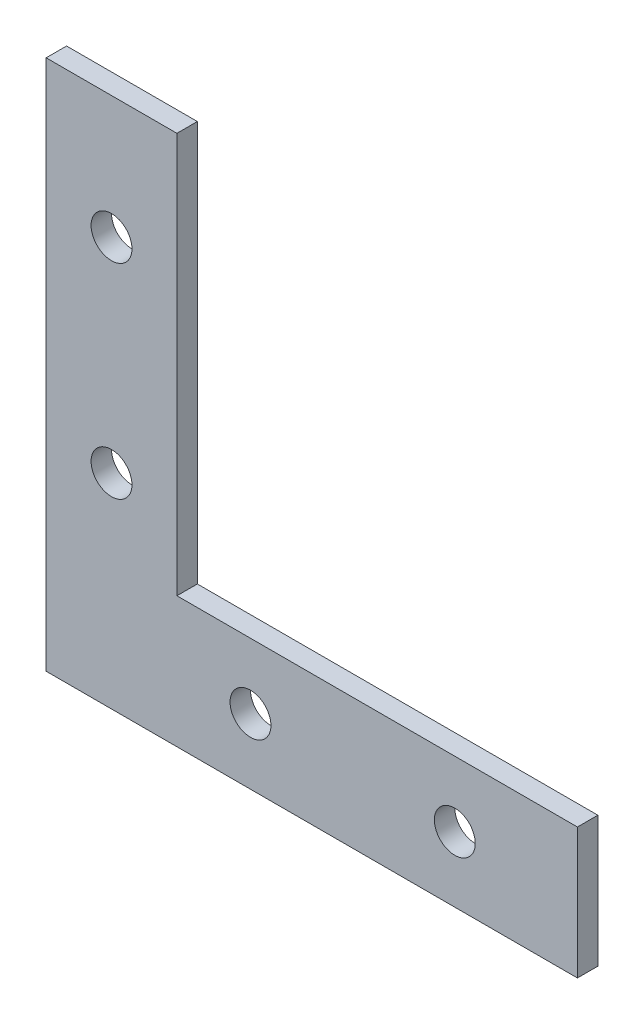
from build123d import *

# Parameters (mm, degrees)
SKETCH1_R           = 2.5
BOSS_EXTRUDE1_DEPTH = 1.25


with BuildPart() as part:
    # Sketch1 → Boss-Extrude1 (new, symmetric)
    with BuildSketch(Plane.XY):
        Polygon((0, 0), (65, 0), (65, 16), (16, 16), (16, 65), (0, 65), align=None)
        with Locations((25, 8)):
            Circle(SKETCH1_R, mode=Mode.SUBTRACT)
        with Locations((50, 8)):
            Circle(SKETCH1_R, mode=Mode.SUBTRACT)
        with Locations(Location((8, 50, 0), (0, 0, 180))):
            Circle(SKETCH1_R, mode=Mode.SUBTRACT)
        with Locations(Location((8, 25, 0), (0, 0, 180))):
            Circle(SKETCH1_R, mode=Mode.SUBTRACT)
    extrude(amount=BOSS_EXTRUDE1_DEPTH, both=True)


solid = part.part
